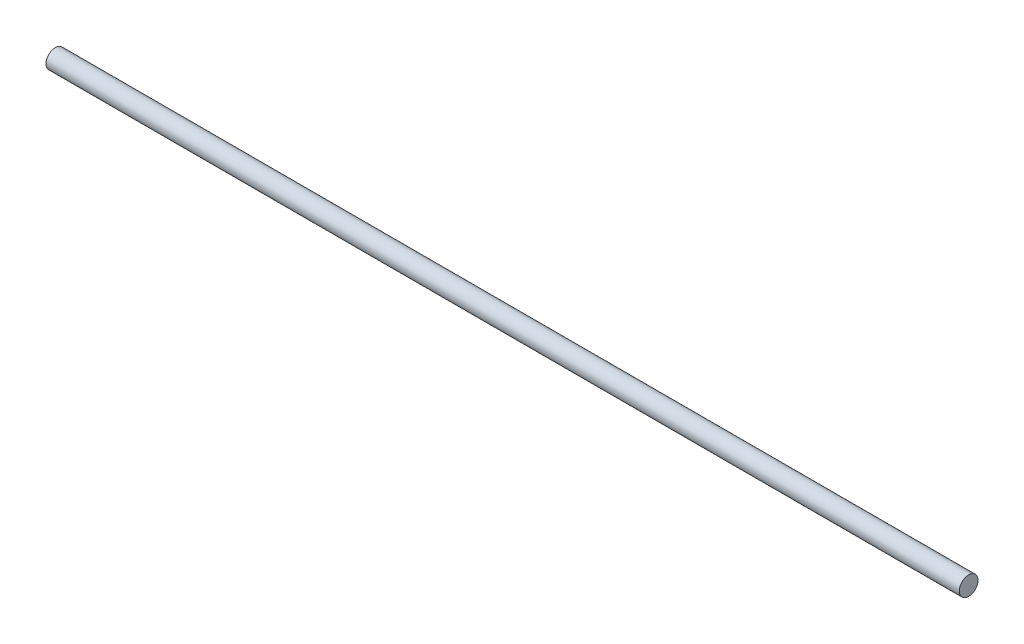
from build123d import *

# Parameters (mm, degrees)
SKETCH_1_R      = 4
EXTRUDE_1_DEPTH = 390


with BuildPart() as part:
    # 草图1 → 凸台-拉伸1 (new body)
    with BuildSketch(Plane(origin=(0, 0, 0), x_dir=(0, 0, -1), z_dir=(1, 0, 0))):
        Circle(SKETCH_1_R)
    extrude(amount=EXTRUDE_1_DEPTH)


solid = part.part
